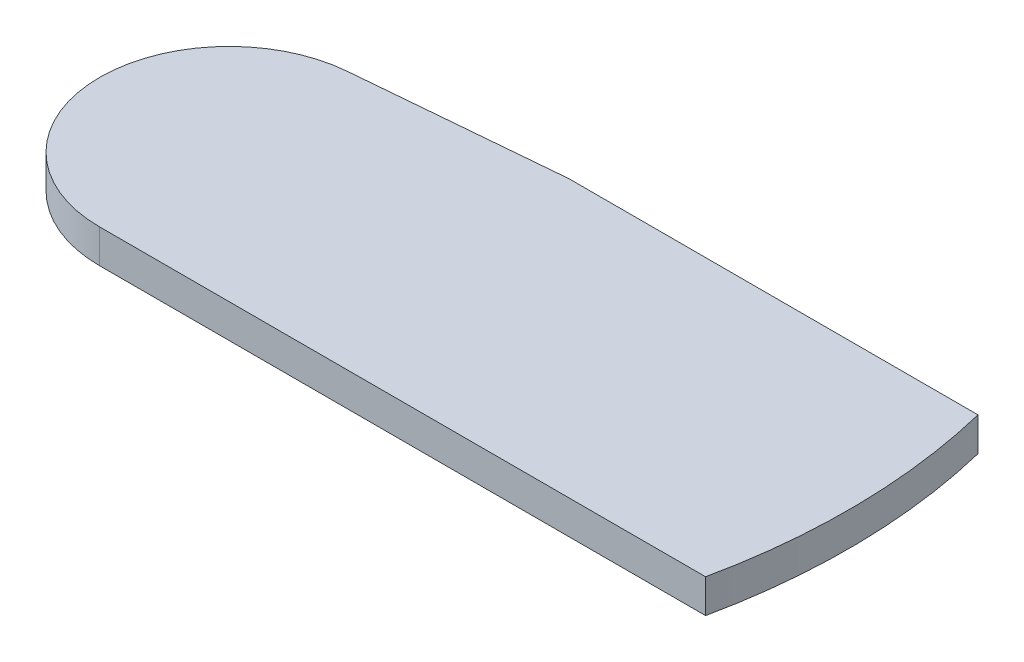
from build123d import *

# Parameters (mm, degrees)
SKETCH1_R           = 10
BOSS_EXTRUDE1_DEPTH = 2.6


with BuildPart() as part:
    # Sketch1 → Boss-Extrude1 (new body)
    with BuildSketch(Plane(origin=(0, 0, 0), x_dir=(1, 0, 0), z_dir=(0, 1, 0))):
        with Locations((-44.462988446, 0)):
            Circle(SKETCH1_R)
        with BuildLine():
            Line((-29.565238745, 11.34310087), (-45.335497693, 9.961863662))
            ThreePointArc((-45.335497693, 9.961863662), (-37.707438597, 7.373096109), (-34.462988446, 0))
            ThreePointArc((-34.462988446, 0), (-37.391920635, -7.071067812), (-44.462988446, -10))
            Line((-44.462988446, -10), (-29.565238745, -10))
            Line((-29.565238745, -10), (-29.565238745, 11.34310087))
        make_face()
        with BuildLine():
            Line((-29.565238745, -10), (2.323097165, -10))
            ThreePointArc((2.323097165, -10), (3.374896218, 0.688910471), (2.015736466, 11.34310087))
            Line((2.015736466, 11.34310087), (-29.565238745, 11.34310087))
            Line((-29.565238745, 11.34310087), (-29.565238745, -10))
        make_face()
    extrude(amount=BOSS_EXTRUDE1_DEPTH)


solid = part.part
